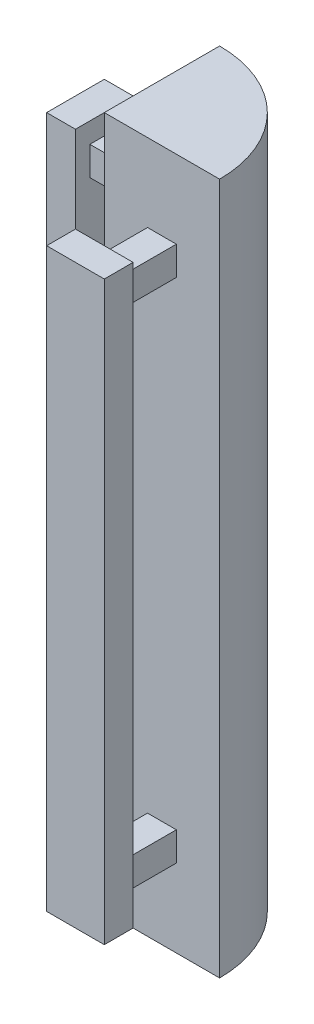
from build123d import *

# Parameters (mm, degrees)
SKETCH1_W               = 38.1
SKETCH1_H               = 101.6
BOSS_EXTRUDE1_DEPTH     = 304.8
CUT_EXTRUDE2_DEPTH      = 324.538575753
SKETCH3_W               = 12.7
SKETCH3_H               = 25.4
CUT_EXTRUDE3_DEPTH      = 324.538575753
CUT_EXTRUDE4_DEPTH      = 324.538575753
CUT_EXTRUDE5_DEPTH      = 152.4
SKETCH6_W               = 6.35
SKETCH6_H               = 6.35
BOSS_EXTRUDE2_DEPTH     = 12.7
SKETCH7_W               = 12.7
SKETCH7_H               = 127
BOSS_EXTRUDE3_DEPTH     = 6.35
MIRROR2_COPY_1_SKETCH_W = 6.35
MIRROR2_COPY_1_SKETCH_H = 6.35
MIRROR2_COPY_1_DEPTH    = 12.7


with BuildPart() as part:
    # Sketch1 → Boss-Extrude1 (new body)
    with BuildSketch(Plane(origin=(0, 0, 0), x_dir=(1, 0, 0), z_dir=(0, 1, 0))):
        with Locations((19.05, 50.8)):
            Rectangle(SKETCH1_W, SKETCH1_H)
    extrude(amount=BOSS_EXTRUDE1_DEPTH)

    # Sketch2 → Cut-Extrude2 (cut, through all)
    with BuildSketch(Plane.XZ):
        Polygon((12.7, -76.2), (38.1, -76.2), (38.1, 0), (0, 0), (0, -76.2), align=None)
    extrude(amount=-CUT_EXTRUDE2_DEPTH, mode=Mode.SUBTRACT)

    # Sketch3 → Cut-Extrude3 (cut, through all)
    with BuildSketch(Plane.XZ):
        with Locations((6.35, -88.9)):
            Rectangle(SKETCH3_W, SKETCH3_H)
    extrude(amount=-CUT_EXTRUDE3_DEPTH, mode=Mode.SUBTRACT)

    # Sketch4 → Cut-Extrude4 (cut, through all)
    with BuildSketch(Plane.XZ):
        with BuildLine():
            ThreePointArc((12.7, -101.6), (30.660512242, -94.160512242), (38.1, -76.2))
            Line((38.1, -76.2), (38.1, -101.6))
            Line((38.1, -101.6), (12.7, -101.6))
        make_face()
    extrude(amount=-CUT_EXTRUDE4_DEPTH, mode=Mode.SUBTRACT)

    # Sketch5 → Cut-Extrude5 (cut)
    with BuildSketch(Plane.XZ):
        with BuildLine():
            Line((12.7, -76.2), (12.7, -101.6))
            ThreePointArc((12.7, -101.6), (30.660512242, -94.160512242), (38.1, -76.2))
            Line((38.1, -76.2), (12.7, -76.2))
        make_face()
    extrude(amount=-CUT_EXTRUDE5_DEPTH, mode=Mode.SUBTRACT)

    # Sketch6 → Boss-Extrude2 (add)
    with BuildSketch(Plane.ZY.offset(-12.7)):
        with Locations((-88.9, 284.458069637)):
            Rectangle(SKETCH6_W, SKETCH6_H)
    boss_extrude2 = extrude(amount=BOSS_EXTRUDE2_DEPTH)

    # Mirror1: Boss-Extrude2 across plane
    add(boss_extrude2.mirror(Plane(origin=(0, 228.6, 0), x_dir=(0, 0, 1), z_dir=(0, -1, 0))))

    # Sketch7 → Boss-Extrude3 (add)
    with BuildSketch(Plane.ZY):
        with Locations((-88.9, 228.6)):
            Rectangle(SKETCH7_W, SKETCH7_H)
    boss_extrude3 = extrude(amount=BOSS_EXTRUDE3_DEPTH)

    # Mirror2: Boss-Extrude2, Boss-Extrude3 across plane
    add(boss_extrude2.mirror(Plane(origin=(-31.75, 0, -31.75), x_dir=(-0.7071067811865479, 0, 0.7071067811865471), z_dir=(0.7071067811865471, 0, 0.7071067811865479))))
    add(boss_extrude3.mirror(Plane(origin=(-31.75, 0, -31.75), x_dir=(-0.7071067811865479, 0, 0.7071067811865471), z_dir=(0.7071067811865471, 0, 0.7071067811865479))))

    # Mirror2 copy 1 sketch → Mirror2 copy 1 (add)
    with BuildSketch(Plane(origin=(-63.5, 457.2, -76.2), x_dir=(-1, 0, 0), z_dir=(0, 0, 1))):
        with Locations((-88.9, 284.458069637)):
            Rectangle(MIRROR2_COPY_1_SKETCH_W, MIRROR2_COPY_1_SKETCH_H)
    extrude(amount=MIRROR2_COPY_1_DEPTH)


solid = part.part
